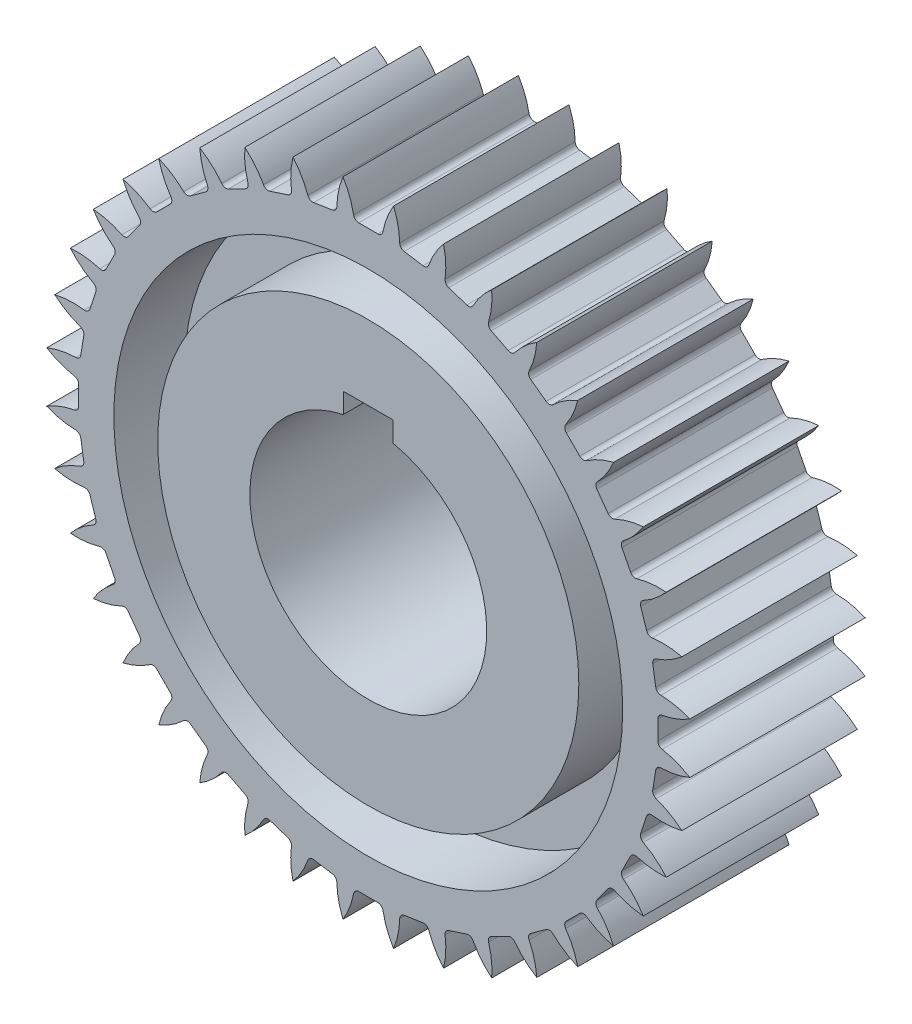
from build123d import *

# Parameters (mm, degrees)
SKETCH1_R           = 18.75
BOSS_EXTRUDE1_DEPTH = 10
CUT_EXTRUDE1_DEPTH  = 29.339460122
SKETCH3_R           = 14.5
SKETCH3_R_2         = 12
CUT_EXTRUDE2_DEPTH  = 4
CUT_EXTRUDE3_START  = -4
SKETCH4_R           = 14.5
SKETCH4_R_2         = 12
CUT_EXTRUDE3_DEPTH  = 4
CUT_EXTRUDE4_DEPTH  = 29.339460122
CIRPATTERN1_COUNT   = 40


with BuildPart() as part:
    # Sketch1 → Boss-Extrude1 (new body)
    with BuildSketch(Plane.XY):
        Circle(SKETCH1_R)
    extrude(amount=BOSS_EXTRUDE1_DEPTH)

    # Sketch2 → Cut-Extrude1 (cut, through all)
    with BuildSketch(Plane.XY.offset(10)):
        with BuildLine():
            Line((-1.421746103, 7.75), (1.421746103, 7.75))
            Line((1.421746103, 7.75), (1.421746103, 6.598570907))
            ThreePointArc((1.421746103, 6.598570907), (0, -6.75), (-1.421746103, 6.598570907))
            Line((-1.421746103, 6.598570907), (-1.421746103, 7.75))
        make_face()
    extrude(amount=-CUT_EXTRUDE1_DEPTH, mode=Mode.SUBTRACT)

    # Sketch3 → Cut-Extrude2 (cut)
    with BuildSketch(Plane.XY.offset(10)):
        Circle(SKETCH3_R)
        Circle(SKETCH3_R_2, mode=Mode.SUBTRACT)
    extrude(amount=-CUT_EXTRUDE2_DEPTH, mode=Mode.SUBTRACT)

    # Sketch4 → Cut-Extrude3 (cut)
    with BuildSketch(Plane(origin=(0, 0, 0), x_dir=(-1, 0, 0), z_dir=(0, 0, -1)).offset(CUT_EXTRUDE3_START)):
        with Locations(Location((0, 0, 0), (0, 0, 180))):
            Circle(SKETCH4_R)
        with Locations(Location((0, 0, 0), (0, 0, 180))):
            Circle(SKETCH4_R_2, mode=Mode.SUBTRACT)
    extrude(amount=CUT_EXTRUDE3_DEPTH, mode=Mode.SUBTRACT)

    # Sketch5 → Cut-Extrude4 (cut, through all)
    with BuildSketch(Plane.XY.offset(10)):
        with BuildLine():
            Line((-0.542651724, 16.501963037), (0.542651724, 16.501963037))
            ThreePointArc((0.542651724, 16.501963037), (0.734898725, 16.571656522), (0.837823302, 16.748355765))
            ThreePointArc((0.837823302, 16.748355765), (1.540768278, 18.478617419), (2.878388266, 19.781963037))
            ThreePointArc((2.878388266, 19.781963037), (0, 20.013595611), (-2.878388266, 19.781963037))
            ThreePointArc((-2.878388266, 19.781963037), (-1.540768278, 18.478617419), (-0.837823302, 16.748355765))
            ThreePointArc((-0.837823302, 16.748355765), (-0.734898725, 16.571656522), (-0.542651724, 16.501963037))
        make_face()
    cut_extrude4 = extrude(amount=-CUT_EXTRUDE4_DEPTH, mode=Mode.SUBTRACT)

    # CirPattern1: Cut-Extrude4 ×40 about axis
    cirpattern1_axis = Axis((0, 0, 0), (0, 0, 1))
    for i in range(1, CIRPATTERN1_COUNT):
        add(cut_extrude4.rotate(cirpattern1_axis, i * 360 / CIRPATTERN1_COUNT), mode=Mode.SUBTRACT)


solid = part.part
